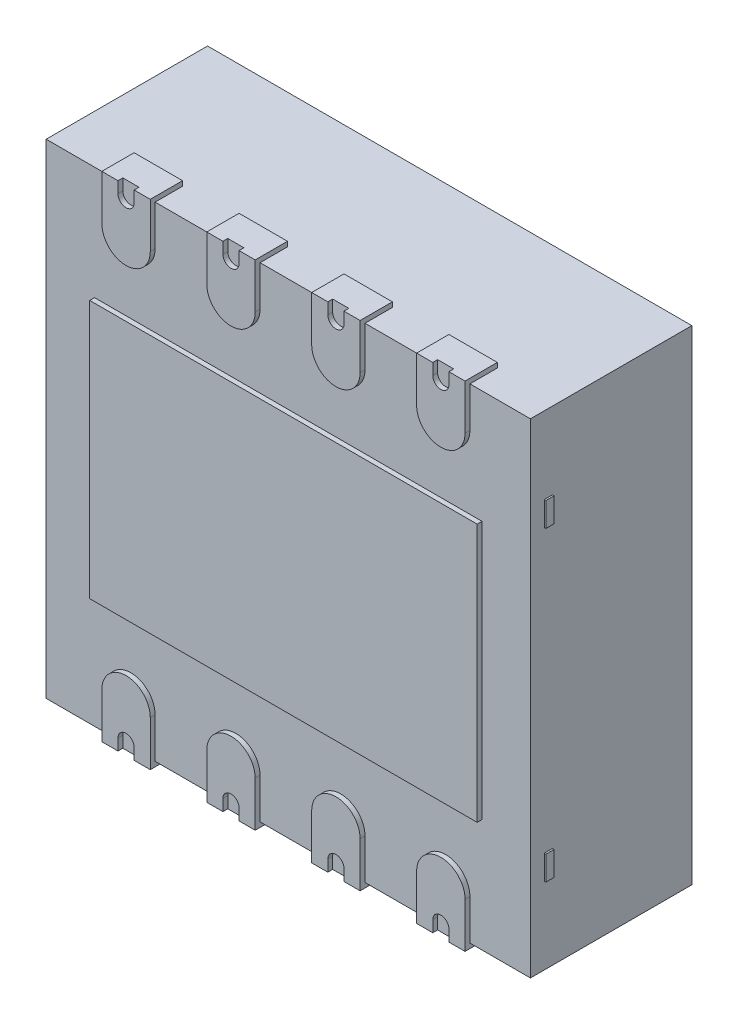
from build123d import *

# Parameters (mm, degrees)
SKETCH1_W            = 3
SKETCH1_H            = 3
BOSS_EXTRUDE1_DEPTH  = 1
SKETCH2_W            = 2.4
SKETCH2_H            = 1.6
BOSS_EXTRUDE2_DEPTH  = 0.03
SKETCH4_W            = 3.940543401
SKETCH4_H            = 3.843561114
SKETCH4_W_2          = 3
SKETCH4_H_2          = 3
CUT_EXTRUDE1_DEPTH   = 60.05
SKETCH7_W            = 0.3
SKETCH7_H            = 0.2
BOSS_EXTRUDE3_DEPTH  = 0.03
CUT_EXTRUDE2_DEPTH   = 0.03
SKETCH9_W            = 0.05
SKETCH9_H            = 0.15
BOSS_EXTRUDE4_DEPTH  = 0.01
BOSS_EXTRUDE9_DEPTH  = 0.01
BOSS_EXTRUDE10_DEPTH = 0.01


with BuildPart() as part:
    # Sketch1 → Boss-Extrude1 (new body)
    with BuildSketch(Plane.XY):
        Rectangle(SKETCH1_W, SKETCH1_H)
    extrude(amount=-BOSS_EXTRUDE1_DEPTH)

    # Sketch2 → Boss-Extrude2 (add)
    with BuildSketch(Plane(origin=(0, 0, 0), x_dir=(-1, 0, 0), z_dir=(0, 0, 1))):
        Rectangle(SKETCH2_W, SKETCH2_H)
        with BuildLine():
            Line((-1.125, 1.25), (-1.125, 1.603517793))
            ThreePointArc((-1.125, 1.603517793), (-0.975, 1.753517793), (-0.825, 1.603517793))
            Line((-0.825, 1.603517793), (-0.825, 1.25))
            ThreePointArc((-0.825, 1.25), (-0.975, 1.1), (-1.125, 1.25))
        make_face()
        with BuildLine():
            Line((-0.175, 1.25), (-0.175, 1.603517793))
            ThreePointArc((-0.175, 1.603517793), (-0.325, 1.753517793), (-0.475, 1.603517793))
            Line((-0.475, 1.603517793), (-0.475, 1.25))
            ThreePointArc((-0.475, 1.25), (-0.325, 1.1), (-0.175, 1.25))
        make_face()
        with BuildLine():
            Line((0.475, 1.25), (0.475, 1.603517793))
            ThreePointArc((0.475, 1.603517793), (0.325, 1.753517793), (0.175, 1.603517793))
            Line((0.175, 1.603517793), (0.175, 1.25))
            ThreePointArc((0.175, 1.25), (0.325, 1.1), (0.475, 1.25))
        make_face()
        with BuildLine():
            Line((1.125, 1.25), (1.125, 1.603517793))
            ThreePointArc((1.125, 1.603517793), (0.975, 1.753517793), (0.825, 1.603517793))
            Line((0.825, 1.603517793), (0.825, 1.25))
            ThreePointArc((0.825, 1.25), (0.975, 1.1), (1.125, 1.25))
        make_face()
        with BuildLine():
            Line((-1.125, -1.25), (-1.125, -1.603517793))
            ThreePointArc((-1.125, -1.603517793), (-0.975, -1.753517793), (-0.825, -1.603517793))
            Line((-0.825, -1.603517793), (-0.825, -1.25))
            ThreePointArc((-0.825, -1.25), (-0.975, -1.1), (-1.125, -1.25))
        make_face()
        with BuildLine():
            Line((-0.475, -1.25), (-0.475, -1.603517793))
            ThreePointArc((-0.475, -1.603517793), (-0.325, -1.753517793), (-0.175, -1.603517793))
            Line((-0.175, -1.603517793), (-0.175, -1.25))
            ThreePointArc((-0.175, -1.25), (-0.325, -1.1), (-0.475, -1.25))
        make_face()
        with BuildLine():
            Line((0.175, -1.25), (0.175, -1.603517793))
            ThreePointArc((0.175, -1.603517793), (0.325, -1.753517793), (0.475, -1.603517793))
            Line((0.475, -1.603517793), (0.475, -1.25))
            ThreePointArc((0.475, -1.25), (0.325, -1.1), (0.175, -1.25))
        make_face()
        with BuildLine():
            Line((0.825, -1.25), (0.825, -1.603517793))
            ThreePointArc((0.825, -1.603517793), (0.975, -1.753517793), (1.125, -1.603517793))
            Line((1.125, -1.603517793), (1.125, -1.25))
            ThreePointArc((1.125, -1.25), (0.975, -1.1), (0.825, -1.25))
        make_face()
    extrude(amount=BOSS_EXTRUDE2_DEPTH)

    # Sketch4 → Cut-Extrude1 (cut)
    with BuildSketch(Plane(origin=(0, 0, -1), x_dir=(-1, 0, 0), z_dir=(0, 0, -1))):
        with Locations((-0.076564963, -0.022969489)):
            Rectangle(SKETCH4_W, SKETCH4_H)
        Rectangle(SKETCH4_W_2, SKETCH4_H_2, mode=Mode.SUBTRACT)
    extrude(amount=-CUT_EXTRUDE1_DEPTH, mode=Mode.SUBTRACT)

    # Sketch7 → Boss-Extrude3 (add)
    with BuildSketch(Plane.XZ.offset(1.5)):
        with Locations((0.975, -0.07)):
            Rectangle(SKETCH7_W, SKETCH7_H)
        with Locations((0.325, -0.07)):
            Rectangle(SKETCH7_W, SKETCH7_H)
        with Locations((-0.325, -0.07)):
            Rectangle(SKETCH7_W, SKETCH7_H)
        with Locations((-0.975, -0.07)):
            Rectangle(SKETCH7_W, SKETCH7_H)
    boss_extrude3 = extrude(amount=BOSS_EXTRUDE3_DEPTH)

    # Mirror1: Boss-Extrude3 across plane
    add(boss_extrude3.mirror(Plane.ZX))

    # Sketch8 → Cut-Extrude2 (cut)
    with BuildSketch(Plane(origin=(0, 0, 0.03), x_dir=(-1, 0, 0), z_dir=(0, 0, 1))):
        with BuildLine():
            Line((-0.925, 1.609812611), (-0.925, 1.459812611))
            ThreePointArc((-0.925, 1.459812611), (-0.975, 1.409812611), (-1.025, 1.459812611))
            Line((-1.025, 1.459812611), (-1.025, 1.609812611))
            ThreePointArc((-1.025, 1.609812611), (-0.975, 1.659812611), (-0.925, 1.609812611))
        make_face()
        with BuildLine():
            Line((-0.375, 1.609812611), (-0.375, 1.459812611))
            ThreePointArc((-0.375, 1.459812611), (-0.325, 1.409812611), (-0.275, 1.459812611))
            Line((-0.275, 1.459812611), (-0.275, 1.609812611))
            ThreePointArc((-0.275, 1.609812611), (-0.325, 1.659812611), (-0.375, 1.609812611))
        make_face()
        with BuildLine():
            Line((0.275, 1.609812611), (0.275, 1.459812611))
            ThreePointArc((0.275, 1.459812611), (0.325, 1.409812611), (0.375, 1.459812611))
            Line((0.375, 1.459812611), (0.375, 1.609812611))
            ThreePointArc((0.375, 1.609812611), (0.325, 1.659812611), (0.275, 1.609812611))
        make_face()
        with BuildLine():
            Line((0.925, 1.609812611), (0.925, 1.459812611))
            ThreePointArc((0.925, 1.459812611), (0.975, 1.409812611), (1.025, 1.459812611))
            Line((1.025, 1.459812611), (1.025, 1.609812611))
            ThreePointArc((1.025, 1.609812611), (0.975, 1.659812611), (0.925, 1.609812611))
        make_face()
        with BuildLine():
            Line((-0.925, -1.609812611), (-0.925, -1.459812611))
            ThreePointArc((-0.925, -1.459812611), (-0.975, -1.409812611), (-1.025, -1.459812611))
            Line((-1.025, -1.459812611), (-1.025, -1.609812611))
            ThreePointArc((-1.025, -1.609812611), (-0.975, -1.659812611), (-0.925, -1.609812611))
        make_face()
        with BuildLine():
            Line((-0.275, -1.609812611), (-0.275, -1.459812611))
            ThreePointArc((-0.275, -1.459812611), (-0.325, -1.409812611), (-0.375, -1.459812611))
            Line((-0.375, -1.459812611), (-0.375, -1.609812611))
            ThreePointArc((-0.375, -1.609812611), (-0.325, -1.659812611), (-0.275, -1.609812611))
        make_face()
        with BuildLine():
            Line((0.375, -1.609812611), (0.375, -1.459812611))
            ThreePointArc((0.375, -1.459812611), (0.325, -1.409812611), (0.275, -1.459812611))
            Line((0.275, -1.459812611), (0.275, -1.609812611))
            ThreePointArc((0.275, -1.609812611), (0.325, -1.659812611), (0.375, -1.609812611))
        make_face()
        with BuildLine():
            Line((1.025, -1.609812611), (1.025, -1.459812611))
            ThreePointArc((1.025, -1.459812611), (0.975, -1.409812611), (0.925, -1.459812611))
            Line((0.925, -1.459812611), (0.925, -1.609812611))
            ThreePointArc((0.925, -1.609812611), (0.975, -1.659812611), (1.025, -1.609812611))
        make_face()
    extrude(amount=-CUT_EXTRUDE2_DEPTH, mode=Mode.SUBTRACT)

    # Sketch9 → Boss-Extrude4 (add)
    with BuildSketch(Plane.ZY.offset(1.5)):
        with Locations((-0.110800284, 0.948643646)):
            Rectangle(SKETCH9_W, SKETCH9_H)
        with Locations((-0.110800284, -0.948643646)):
            Rectangle(SKETCH9_W, SKETCH9_H)
    boss_extrude4 = extrude(amount=BOSS_EXTRUDE4_DEPTH)

    # Mirror2: Boss-Extrude4 across plane
    add(boss_extrude4.mirror(Plane(origin=(0, 0, 0), x_dir=(0, 0, 1), z_dir=(1, 0, 0))))

    # Sketch11 → Boss-Extrude9 (add)
    # profile 1 of 2: a face of its own
    with BuildSketch(Plane(origin=(0, 0, -1), x_dir=(-1, 0, 0), z_dir=(0, 0, -1))):
        with BuildLine():
            Line((-0.805854291, 1.038109942), (-0.423255467, 0.605441833))
            Line((-0.423255467, 0.605441833), (-0.423255467, 1.038109942))
            Line((-0.423255467, 1.038109942), (-0.097177649, 1.038109942))
            Line((-0.097177649, 1.038109942), (0.052640904, 0.796577554))
            Line((0.052640904, 0.796577554), (0.201820168, 1.038109942))
            Line((0.201820168, 1.038109942), (0.943650762, 1.038109942))
            ThreePointArc((0.943650762, 1.038109942), (1.045474138, 0.995933319), (1.087650762, 0.894109942))
            Line((1.087650762, 0.894109942), (1.087650762, 0.670379201))
            ThreePointArc((1.087650762, 0.670379201), (1.045474138, 0.568555824), (0.943650762, 0.526379201))
            Line((0.943650762, 0.526379201), (0.543475021, 0.526379201))
            Line((0.543475021, 0.526379201), (0.543475021, 0.206356726))
            Line((0.543475021, 0.206356726), (0.201820168, 0.206356726))
            Line((0.201820168, 0.206356726), (0.052640904, 0.446858476))
            Line((0.052640904, 0.446858476), (-0.093279754, 0.210602016))
            Line((-0.093279754, 0.210602016), (-0.396062037, 0.210602016))
            Line((-0.396062037, 0.210602016), (-0.788189355, 0.654045576))
            Line((-0.788189355, 0.654045576), (-0.788189355, 0.214790298))
            Line((-0.788189355, 0.214790298), (-1.067573051, 0.214790298))
            Line((-1.067573051, 0.214790298), (-1.067573051, 1.038109942))
            Line((-1.067573051, 1.038109942), (-0.805854291, 1.038109942))
        make_face()
        Polygon((-0.362302815, 0.999733668), (-0.118839535, 0.999733668), (0.05523679, 0.721091876), (0.222284334, 0.999733668), (0.465308002, 0.999733668), (0.23905049, 0.622327348), (0.473025575, 0.247806363), (0.231595523, 0.247806363), (0.05523679, 0.530101575), (-0.112552144, 0.250223114), (-0.362302815, 0.250223114), (-0.125560237, 0.626220348), align=None, mode=Mode.SUBTRACT)
        with BuildLine():
            Line((0.51730694, 0.999733668), (0.910767238, 0.994219094))
            ThreePointArc((0.910767238, 0.994219094), (1.011989543, 0.950619639), (1.052735051, 0.84821519))
            Line((1.052735051, 0.84821519), (1.050676437, 0.701334767))
            ThreePointArc((1.050676437, 0.701334767), (1.007797951, 0.600818431), (0.906690578, 0.559352812))
            Line((0.906690578, 0.559352812), (0.501176929, 0.559352812))
            Line((0.501176929, 0.559352812), (0.501176929, 0.269954806))
            Line((0.501176929, 0.269954806), (0.288716116, 0.622327348))
            Line((0.288716116, 0.622327348), (0.51730694, 0.999733668))
        make_face(mode=Mode.SUBTRACT)
        Polygon((-1.028178054, 0.254481122), (-1.028178054, 0.991192026), (-0.812896495, 0.991192026), (-0.374426195, 0.481817999), (-0.374426195, 0.939702526), (-0.178785, 0.626220348), (-0.398074818, 0.261293182), (-0.82547709, 0.757809403), (-0.82547709, 0.254481122), align=None, mode=Mode.SUBTRACT)
    # profile 2 of 2: a face of its own
    with BuildSketch(Plane(origin=(0, 0, -1), x_dir=(-1, 0, 0), z_dir=(0, 0, -1))):
        with BuildLine():
            Line((0.501176929, 0.890202885), (0.501176929, 0.670379201))
            Line((0.501176929, 0.670379201), (0.874246648, 0.670379201))
            ThreePointArc((0.874246648, 0.670379201), (0.908187774, 0.684438075), (0.922246648, 0.718379201))
            Line((0.922246648, 0.718379201), (0.922246648, 0.842202885))
            ThreePointArc((0.922246648, 0.842202885), (0.908187774, 0.876144011), (0.874246648, 0.890202885))
            Line((0.874246648, 0.890202885), (0.501176929, 0.890202885))
        make_face()
        with BuildLine():
            Line((0.539738286, 0.850364718), (0.829407549, 0.850364718))
            ThreePointArc((0.829407549, 0.850364718), (0.863348674, 0.836305844), (0.877407549, 0.802364718))
            Line((0.877407549, 0.802364718), (0.877407549, 0.760827608))
            ThreePointArc((0.877407549, 0.760827608), (0.863348674, 0.726886482), (0.829407549, 0.712827608))
            Line((0.829407549, 0.712827608), (0.539738286, 0.712827608))
            Line((0.539738286, 0.712827608), (0.539738286, 0.850364718))
        make_face(mode=Mode.SUBTRACT)
    extrude(amount=BOSS_EXTRUDE9_DEPTH)

    # Sketch12 → Boss-Extrude10 (add)
    # profile 1 of 7: a face of its own
    with BuildSketch(Plane(origin=(0, 0, -1), x_dir=(-1, 0, 0), z_dir=(0, 0, -1))):
        Polygon((-1.037035456, -0.548636153), (-0.821650841, -0.548636153), (-0.821650841, -0.620431025), (-0.893445713, -0.620431025), (-0.893445713, -0.948636153), (-0.965240585, -0.948636153), (-0.965240585, -0.620431025), (-1.037035456, -0.620431025), align=None)
    # profile 2 of 7: a face of its own
    with BuildSketch(Plane(origin=(0, 0, -1), x_dir=(-1, 0, 0), z_dir=(0, 0, -1))):
        with BuildLine():
            Line((-0.662676482, -0.548636153), (-0.59088161, -0.548636153))
            Line((-0.59088161, -0.548636153), (-0.59088161, -0.814181025))
            add(Edge.make_bspline(
                [(-0.59088161, -0.814181025), (-0.590907932, -0.819256306), (-0.59095865, -0.82903537), (-0.591466423, -0.843113611), (-0.592153022, -0.856021258), (-0.59314179, -0.867737628), (-0.594610382, -0.878262153), (-0.596272382, -0.887621092), (-0.59810603, -0.895852581), (-0.60120351, -0.905064896), (-0.606012259, -0.915266488), (-0.613268798, -0.926285657), (-0.622305512, -0.935859438), (-0.632712821, -0.944175372), (-0.644578415, -0.950760019), (-0.657628938, -0.95551942), (-0.671822672, -0.958362719), (-0.681653617, -0.958712489), (-0.686714944, -0.958892564)],
                knots=[0, 0, 0, 0, 1.22248561, 2.355488409, 3.392943897, 4.335991845, 5.186735882, 5.951517034, 6.625683685, 7.215700098, 8.28923535, 9.333114649, 10.380102123, 11.447198135, 12.530158036, 13.633358744, 14.781567393, 16, 16, 16, 16], degree=3))
            add(Edge.make_bspline(
                [(-0.686714944, -0.958892564), (-0.691988385, -0.958729304), (-0.702389672, -0.958407292), (-0.717644229, -0.955664578), (-0.732305766, -0.951267182), (-0.746298431, -0.944909075), (-0.759813927, -0.936944688), (-0.772606962, -0.92706564), (-0.784944636, -0.915578324), (-0.792258484, -0.906763247), (-0.796009815, -0.902241923)],
                knots=[0, 0, 0, 0, 0.990984786, 1.954608977, 2.90473533, 3.862451285, 4.837525908, 5.848096122, 6.896271184, 8, 8, 8, 8], degree=3))
            Line((-0.796009815, -0.902241923), (-0.741682892, -0.852001538))
            add(Edge.make_bspline(
                [(-0.741682892, -0.852001538), (-0.738838396, -0.85521786), (-0.733515579, -0.861236464), (-0.72549425, -0.86908487), (-0.718258579, -0.875390159), (-0.711437736, -0.87993822), (-0.70500107, -0.883144096), (-0.698810093, -0.885453379), (-0.692671821, -0.886760564), (-0.688616691, -0.886987017), (-0.686634815, -0.887097692)],
                knots=[0, 0, 0, 0, 1.529509877, 2.862124173, 3.996688592, 4.944357383, 5.774364335, 6.554177287, 7.293378699, 8, 8, 8, 8], degree=3))
            add(Edge.make_bspline(
                [(-0.686634815, -0.887097692), (-0.68471658, -0.886997659), (-0.681028445, -0.886805329), (-0.675957117, -0.884667333), (-0.671681662, -0.881310591), (-0.668866954, -0.87745158), (-0.66707324, -0.873506631), (-0.665952494, -0.869693232), (-0.664888904, -0.865122), (-0.66403678, -0.859795227), (-0.663392913, -0.853643431), (-0.663071992, -0.846741295), (-0.66268171, -0.839051521), (-0.662678287, -0.833679547), (-0.662676482, -0.830847692)],
                knots=[0, 0, 0, 0, 1.003927327, 1.930222208, 2.840933547, 3.835773585, 4.407906147, 5.114514582, 5.922289074, 6.876303333, 7.950072246, 9.174518422, 10.510537432, 12, 12, 12, 12], degree=3))
            Line((-0.662676482, -0.830847692), (-0.662676482, -0.548636153))
        make_face()
    # profile 3 of 7: a face of its own
    with BuildSketch(Plane(origin=(0, 0, -1), x_dir=(-1, 0, 0), z_dir=(0, 0, -1))):
        Polygon((-0.375416867, -0.548636153), (-0.308830328, -0.548636153), (-0.147291867, -0.948636153), (-0.223974559, -0.948636153), (-0.255064303, -0.866584871), (-0.429343149, -0.866584871), (-0.460432892, -0.948636153), (-0.537035456, -0.948636153), align=None)
        Polygon((-0.342163662, -0.65592782), (-0.402099559, -0.79479), (-0.282227764, -0.79479), align=None, mode=Mode.SUBTRACT)
    # profile 4 of 7: a face of its own
    with BuildSketch(Plane(origin=(0, 0, -1), x_dir=(-1, 0, 0), z_dir=(0, 0, -1))):
        Polygon((-0.045448918, -0.548636153), (0.065528646, -0.548636153), (0.065528646, -0.948636153), (-0.006266226, -0.948636153), (-0.006266226, -0.61530282), (-0.088317508, -0.61530282), align=None)
    # profile 5 of 7: a face of its own
    with BuildSketch(Plane(origin=(0, 0, -1), x_dir=(-1, 0, 0), z_dir=(0, 0, -1))):
        Polygon((0.349663261, -0.538379743), (0.424503005, -0.538379743), (0.424503005, -0.799918205), (0.460400441, -0.799918205), (0.460400441, -0.866584871), (0.424503005, -0.866584871), (0.424503005, -0.948636153), (0.352708133, -0.948636153), (0.352708133, -0.866584871), (0.183477364, -0.866584871), (0.183477364, -0.793908589), align=None)
        Polygon((0.352708133, -0.799918205), (0.352708133, -0.663780384), (0.264166467, -0.799918205), align=None, mode=Mode.SUBTRACT)
    # profile 6 of 7: a face of its own
    with BuildSketch(Plane(origin=(0, 0, -1), x_dir=(-1, 0, 0), z_dir=(0, 0, -1))):
        Polygon((0.657355569, -0.538379743), (0.732195313, -0.538379743), (0.732195313, -0.799918205), (0.768092749, -0.799918205), (0.768092749, -0.866584871), (0.732195313, -0.866584871), (0.732195313, -0.948636153), (0.660400441, -0.948636153), (0.660400441, -0.866584871), (0.491169672, -0.866584871), (0.491169672, -0.793908589), align=None)
        Polygon((0.660400441, -0.799918205), (0.660400441, -0.663780384), (0.571858774, -0.799918205), align=None, mode=Mode.SUBTRACT)
    # profile 7 of 7: a face of its own
    with BuildSketch(Plane(origin=(0, 0, -1), x_dir=(-1, 0, 0), z_dir=(0, 0, -1))):
        with BuildLine():
            Line((0.880913261, -0.681969487), (0.80911839, -0.681969487))
            add(Edge.make_bspline(
                [(0.80911839, -0.681969487), (0.809428461, -0.676538585), (0.810034321, -0.665926928), (0.81244428, -0.650513156), (0.815673542, -0.635948837), (0.81998342, -0.622284918), (0.825399065, -0.609526364), (0.831781117, -0.597629681), (0.839292624, -0.586657504), (0.847773715, -0.576662747), (0.857080406, -0.567696359), (0.867019479, -0.559746196), (0.877742968, -0.553185922), (0.889054944, -0.547787424), (0.900953482, -0.543474274), (0.91355116, -0.540590585), (0.926738901, -0.538637722), (0.935766978, -0.538466839), (0.94036839, -0.538379743)],
                knots=[0, 0, 0, 0, 1.199038563, 2.342849363, 3.436047546, 4.486744587, 5.497670872, 6.488682221, 7.459191391, 8.424610317, 9.374430501, 10.305433194, 11.225809216, 12.140057399, 13.06607119, 14.010487599, 14.985989317, 16, 16, 16, 16], degree=3))
            add(Edge.make_bspline(
                [(0.94036839, -0.538379743), (0.946016558, -0.538555981), (0.957043105, -0.538900038), (0.973065553, -0.541834962), (0.988028768, -0.546744075), (1.001921872, -0.5536034), (1.014626592, -0.562317454), (1.02614082, -0.572707537), (1.036116348, -0.584991638), (1.044616424, -0.598658637), (1.051678971, -0.613130065), (1.05662811, -0.628094122), (1.059881126, -0.643153723), (1.06022808, -0.653294095), (1.060400441, -0.658331666)],
                knots=[0, 0, 0, 0, 1.075374347, 2.099382735, 3.09057751, 4.06680945, 5.040638231, 6.016817125, 7.011024321, 8.044445721, 9.0776792, 10.070479129, 11.0414456, 12, 12, 12, 12], degree=3))
            add(Edge.make_bspline(
                [(1.060400441, -0.658331666), (1.060333333, -0.661378745), (1.06019826, -0.667511763), (1.059259083, -0.676792524), (1.057850131, -0.686246064), (1.055725776, -0.695864277), (1.053076531, -0.70564986), (1.049862613, -0.715632098), (1.046009474, -0.725754395), (1.041581413, -0.736130676), (1.036298725, -0.746794628), (1.03014777, -0.757906108), (1.022965286, -0.76945526), (1.01483803, -0.781507293), (1.005726528, -0.7940432), (0.995586303, -0.807025219), (0.984534144, -0.820499095), (0.976690117, -0.829505624), (0.972660056, -0.834132948)],
                knots=[0, 0, 0, 0, 0.728284026, 1.46585585, 2.227944881, 3.01186502, 3.81876927, 4.650621989, 5.517437689, 6.406905708, 7.346299482, 8.360816762, 9.441613733, 10.596154504, 11.834900912, 13.145207542, 14.533280747, 16, 16, 16, 16], degree=3))
            Line((0.972660056, -0.834132948), (0.930913261, -0.881969487))
            Line((0.930913261, -0.881969487), (1.065528646, -0.881969487))
            Line((1.065528646, -0.881969487), (1.065528646, -0.948636153))
            Line((1.065528646, -0.948636153), (0.798861979, -0.948636153))
            Line((0.798861979, -0.948636153), (0.798861979, -0.912257948))
            Line((0.798861979, -0.912257948), (0.917291467, -0.786216282))
            add(Edge.make_bspline(
                [(0.917291467, -0.786216282), (0.920720305, -0.782539607), (0.927360947, -0.775418979), (0.936809897, -0.764961579), (0.945360361, -0.755037756), (0.952835041, -0.745541841), (0.959626195, -0.736781843), (0.965431009, -0.728493725), (0.970302591, -0.720752415), (0.975591384, -0.711417747), (0.980613999, -0.700284494), (0.985222552, -0.68745853), (0.988031784, -0.675199862), (0.988419547, -0.667211851), (0.988605569, -0.663379743)],
                knots=[0, 0, 0, 0, 1.246127091, 2.413378631, 3.493388633, 4.492180848, 5.408488754, 6.240484944, 6.999099869, 7.674939598, 8.898438119, 10.020720584, 11.050475521, 12, 12, 12, 12], degree=3))
            add(Edge.make_bspline(
                [(0.988605569, -0.663379743), (0.988466485, -0.659672474), (0.988196986, -0.652489047), (0.985235417, -0.642270659), (0.980647251, -0.633018953), (0.974181876, -0.625010378), (0.966350283, -0.618429201), (0.957300142, -0.613534307), (0.947105237, -0.610709975), (0.939958415, -0.61035647), (0.936281851, -0.610174615)],
                knots=[0, 0, 0, 0, 1.062038974, 2.057870785, 3.028805853, 4.01125022, 4.991535629, 5.949134679, 6.94496649, 8, 8, 8, 8], degree=3))
            add(Edge.make_bspline(
                [(0.936281851, -0.610174615), (0.934382492, -0.610241794), (0.930643297, -0.610374048), (0.925146973, -0.611254423), (0.919916827, -0.612805993), (0.914894642, -0.614884878), (0.910134018, -0.617640455), (0.905646962, -0.621037143), (0.901386198, -0.624988624), (0.897371267, -0.629482543), (0.893717155, -0.634497757), (0.890471587, -0.639988464), (0.887788042, -0.645951254), (0.885425351, -0.65230741), (0.883603131, -0.659125203), (0.882276329, -0.666363828), (0.88126765, -0.674011509), (0.88103354, -0.679268571), (0.880913261, -0.681969487)],
                knots=[0, 0, 0, 0, 0.903469896, 1.778625579, 2.63899355, 3.493148037, 4.358286772, 5.247621495, 6.164656832, 7.118446693, 8.109501108, 9.111810964, 10.146451449, 11.215617525, 12.33435995, 13.498009769, 14.714554818, 16, 16, 16, 16], degree=3))
        make_face()
    extrude(amount=BOSS_EXTRUDE10_DEPTH)


solid = part.part
